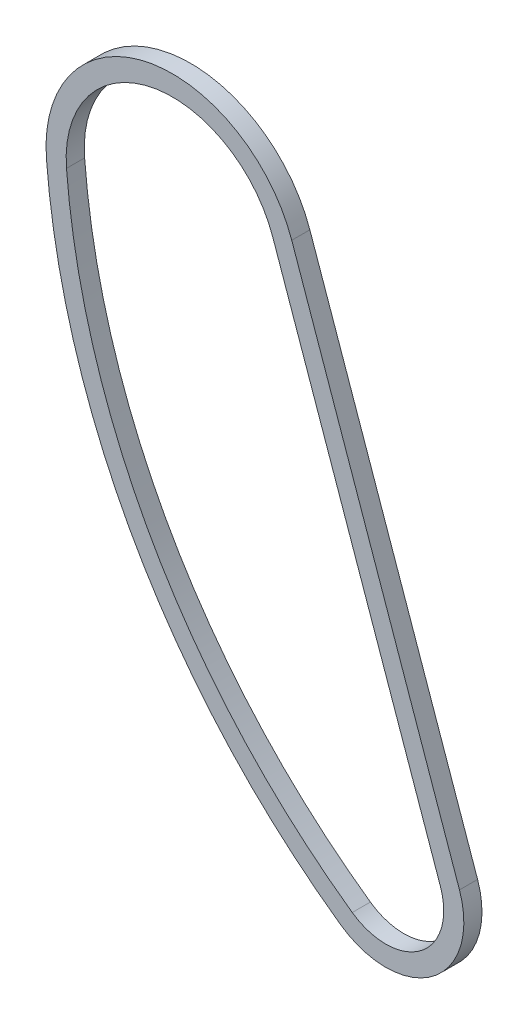
from build123d import *

# Parameters (mm, degrees)
BOSS_EXTRUDE1_DEPTH = 4.5


with BuildPart() as part:
    # Sketch1 → Boss-Extrude1 (new body)
    with BuildSketch(Plane.XY):
        with BuildLine():
            Line((71.318213966, -108.561967819), (29.643230329, 10.3859037))
            ThreePointArc((29.643230329, 10.3859037), (-6.509198083, 30.728137599), (-31.308299059, -2.525571229))
            ThreePointArc((-31.308299059, -2.525571229), (-9.015287266, -74.800110093), (41.79304757, -130.827785878))
            ThreePointArc((41.79304757, -130.827785878), (64.686923189, -130.477223183), (71.318213966, -108.561967819))
        make_face()
        with BuildLine():
            Line((66.599457149, -110.215247618), (24.924473511, 8.732623901))
            ThreePointArc((24.924473511, 8.732623901), (-5.473031562, 25.836679847), (-26.324488321, -2.123538241))
            ThreePointArc((-26.324488321, -2.123538241), (-4.670950627, -72.32488502), (44.679949278, -126.7454093))
            ThreePointArc((44.679949278, -126.7454093), (61.676381409, -126.485151265), (66.599457149, -110.215247618))
        make_face(mode=Mode.SUBTRACT)
    extrude(amount=BOSS_EXTRUDE1_DEPTH)


solid = part.part
